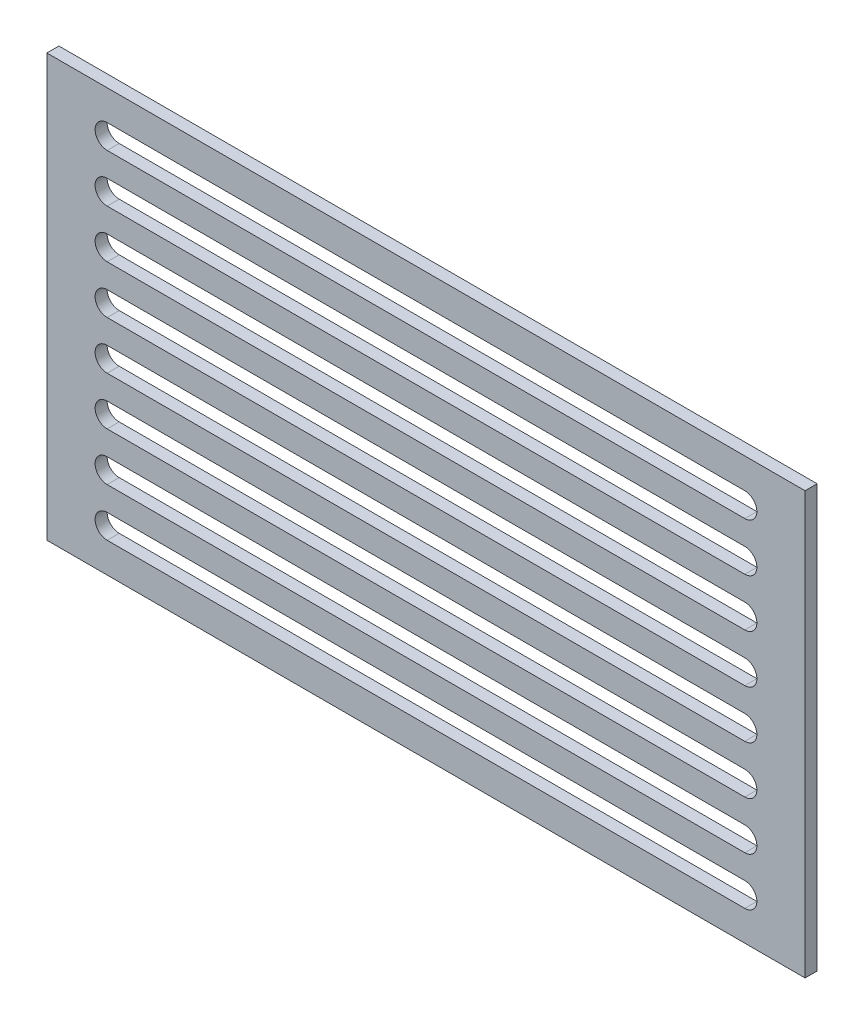
from build123d import *

# Parameters (mm, degrees)
SKETCH_1_W      = 125.77
SKETCH_1_H      = 70
EXTRUDE_1_DEPTH = 2


with BuildPart() as part:
    # 草图1 → 凸台-拉伸1 (new body)
    with BuildSketch(Plane.XY):
        Rectangle(SKETCH_1_W, SKETCH_1_H)
        with BuildLine():
            Line((-52.885, -18), (52.885, -18))
            ThreePointArc((52.885, -18), (54.885, -20), (52.885, -22))
            Line((52.885, -22), (-52.885, -22))
            ThreePointArc((-52.885, -22), (-54.885, -20), (-52.885, -18))
        make_face(mode=Mode.SUBTRACT)
        with BuildLine():
            Line((-52.885, -10), (52.885, -10))
            ThreePointArc((52.885, -10), (54.885, -12), (52.885, -14))
            Line((52.885, -14), (-52.885, -14))
            ThreePointArc((-52.885, -14), (-54.885, -12), (-52.885, -10))
        make_face(mode=Mode.SUBTRACT)
        with BuildLine():
            Line((-52.885, -2), (52.885, -2))
            ThreePointArc((52.885, -2), (54.885, -4), (52.885, -6))
            Line((52.885, -6), (-52.885, -6))
            ThreePointArc((-52.885, -6), (-54.885, -4), (-52.885, -2))
        make_face(mode=Mode.SUBTRACT)
        with BuildLine():
            Line((-52.885, 6), (52.885, 6))
            ThreePointArc((52.885, 6), (54.885, 4), (52.885, 2))
            Line((52.885, 2), (-52.885, 2))
            ThreePointArc((-52.885, 2), (-54.885, 4), (-52.885, 6))
        make_face(mode=Mode.SUBTRACT)
        with BuildLine():
            Line((-52.885, 14), (52.885, 14))
            ThreePointArc((52.885, 14), (54.885, 12), (52.885, 10))
            Line((52.885, 10), (-52.885, 10))
            ThreePointArc((-52.885, 10), (-54.885, 12), (-52.885, 14))
        make_face(mode=Mode.SUBTRACT)
        with BuildLine():
            Line((-52.885, 22), (52.885, 22))
            ThreePointArc((52.885, 22), (54.885, 20), (52.885, 18))
            Line((52.885, 18), (-52.885, 18))
            ThreePointArc((-52.885, 18), (-54.885, 20), (-52.885, 22))
        make_face(mode=Mode.SUBTRACT)
        with BuildLine():
            Line((-52.885, 30), (52.885, 30))
            ThreePointArc((52.885, 30), (54.885, 28), (52.885, 26))
            Line((52.885, 26), (-52.885, 26))
            ThreePointArc((-52.885, 26), (-54.885, 28), (-52.885, 30))
        make_face(mode=Mode.SUBTRACT)
        with BuildLine():
            Line((-52.885, -26), (52.885, -26))
            ThreePointArc((52.885, -26), (54.885, -28), (52.885, -30))
            Line((52.885, -30), (-52.885, -30))
            ThreePointArc((-52.885, -30), (-54.885, -28), (-52.885, -26))
        make_face(mode=Mode.SUBTRACT)
    extrude(amount=EXTRUDE_1_DEPTH)


solid = part.part
